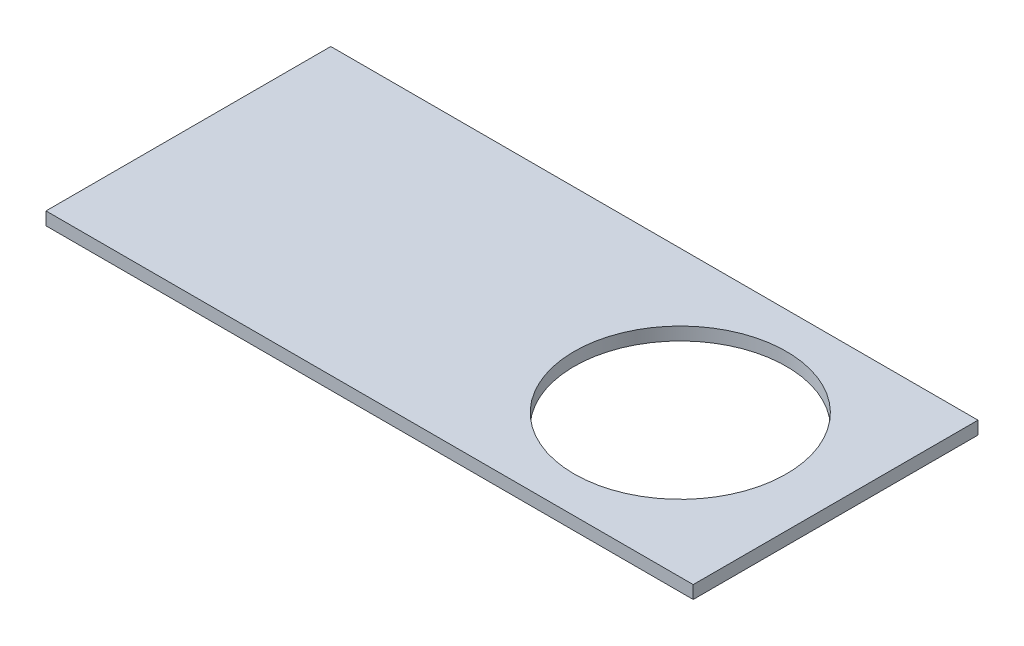
from build123d import *

# Parameters (mm, degrees)
SKETCH_1_W      = 250
SKETCH_1_H      = 110
SKETCH_1_R      = 41
EXTRUDE_1_DEPTH = 5


with BuildPart() as part:
    # Эскиз1 → Бобышка-Вытянуть1 (new body)
    with BuildSketch(Plane(origin=(0, 0, 0), x_dir=(1, 0, 0), z_dir=(0, 1, 0))):
        Rectangle(SKETCH_1_W, SKETCH_1_H)
        with Locations(Location((65, 0, 0), (0, 0, 270))):
            Circle(SKETCH_1_R, mode=Mode.SUBTRACT)
    extrude(amount=EXTRUDE_1_DEPTH)


solid = part.part
